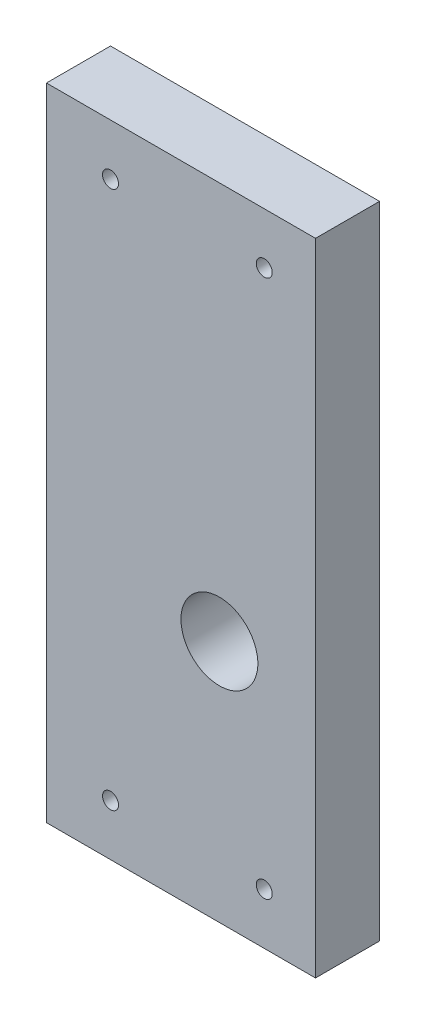
from build123d import *

# Parameters (mm, degrees)
SKETCH1_W                      = 42
SKETCH1_H                      = 100
BOSS_EXTRUDE1_DEPTH            = 10
F_12_0_12_DIAMETER_HOLE1_D     = 12
F_2_5_2_5_DIAMETER_HOLE1_D     = 2.5
F_2_5_2_5_DIAMETER_HOLE2_D     = 2.5
F_2_5_2_5_DIAMETER_HOLE2_DEPTH = 7.5
F_2_5_2_5_DIAMETER_HOLE2_TIP   = 0.751075774


with BuildPart() as part:
    # Sketch1 → Boss-Extrude1 (new body)
    with BuildSketch(Plane.XY.offset(10)):
        Rectangle(SKETCH1_W, SKETCH1_H)
    extrude(amount=-BOSS_EXTRUDE1_DEPTH)

    # Ø12.0 (12) Diameter Hole1 (through all)
    with Locations(Plane(origin=(0, 0, 0), x_dir=(-1, 0, 0), z_dir=(0, 0, -1))):
        with Locations((-6, -12)):
            Hole(F_12_0_12_DIAMETER_HOLE1_D / 2)

    # Ø2.5 (2.5) Diameter Hole1 (through all)
    with Locations(Plane.XY.offset(10)):
        with Locations((13, 42), (-11, 42), (-11, -42), (13, -42)):
            Hole(F_2_5_2_5_DIAMETER_HOLE1_D / 2)

    # Ø2.5 (2.5) Diameter Hole2
    with Locations(Plane.ZY.offset(21)):
        with Locations((5, 45), (5, -45)):
            Hole(F_2_5_2_5_DIAMETER_HOLE2_D / 2, depth=F_2_5_2_5_DIAMETER_HOLE2_DEPTH)
            with Locations((0, 0, -(F_2_5_2_5_DIAMETER_HOLE2_DEPTH + F_2_5_2_5_DIAMETER_HOLE2_TIP / 2))):  # 118° drill point
                Cone(0, F_2_5_2_5_DIAMETER_HOLE2_D / 2, F_2_5_2_5_DIAMETER_HOLE2_TIP, mode=Mode.SUBTRACT)


solid = part.part
